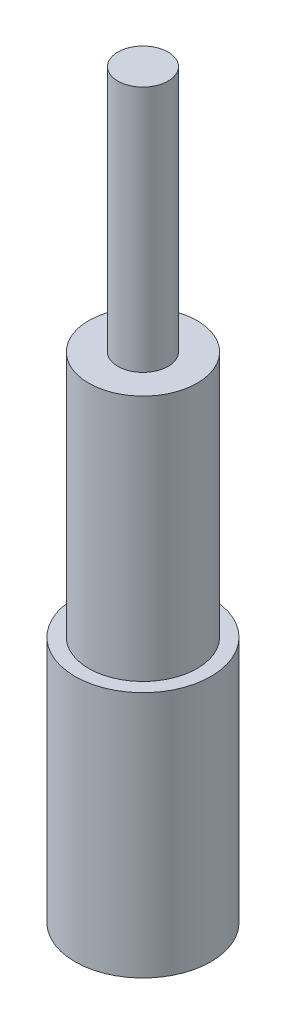
from build123d import *

# Parameters (mm, degrees)
SKETCH1_R           = 5.5
BOSS_EXTRUDE1_DEPTH = 20
SKETCH2_R           = 4.387958665
BOSS_EXTRUDE2_DEPTH = 20
SKETCH3_R           = 2.035753475
BOSS_EXTRUDE3_DEPTH = 20


with BuildPart() as part:
    # Sketch1 → Boss-Extrude1 (new body)
    with BuildSketch(Plane(origin=(0, 0, 0), x_dir=(1, 0, 0), z_dir=(0, 1, 0))):
        with Locations(Location((0, 0, 0), (0, 0, 270))):
            Circle(SKETCH1_R)
    extrude(amount=BOSS_EXTRUDE1_DEPTH)

    # Sketch2 → Boss-Extrude2 (add)
    with BuildSketch(Plane(origin=(0, 20, 0), x_dir=(1, 0, 0), z_dir=(0, 1, 0))):
        with Locations(Location((0, 0, 0), (0, 0, 270))):
            Circle(SKETCH2_R)
    extrude(amount=BOSS_EXTRUDE2_DEPTH)

    # Sketch3 → Boss-Extrude3 (add)
    with BuildSketch(Plane(origin=(0, 40, 0), x_dir=(1, 0, 0), z_dir=(0, 1, 0))):
        with Locations(Location((0, 0, 0), (0, 0, 270))):
            Circle(SKETCH3_R)
    extrude(amount=BOSS_EXTRUDE3_DEPTH)


solid = part.part
